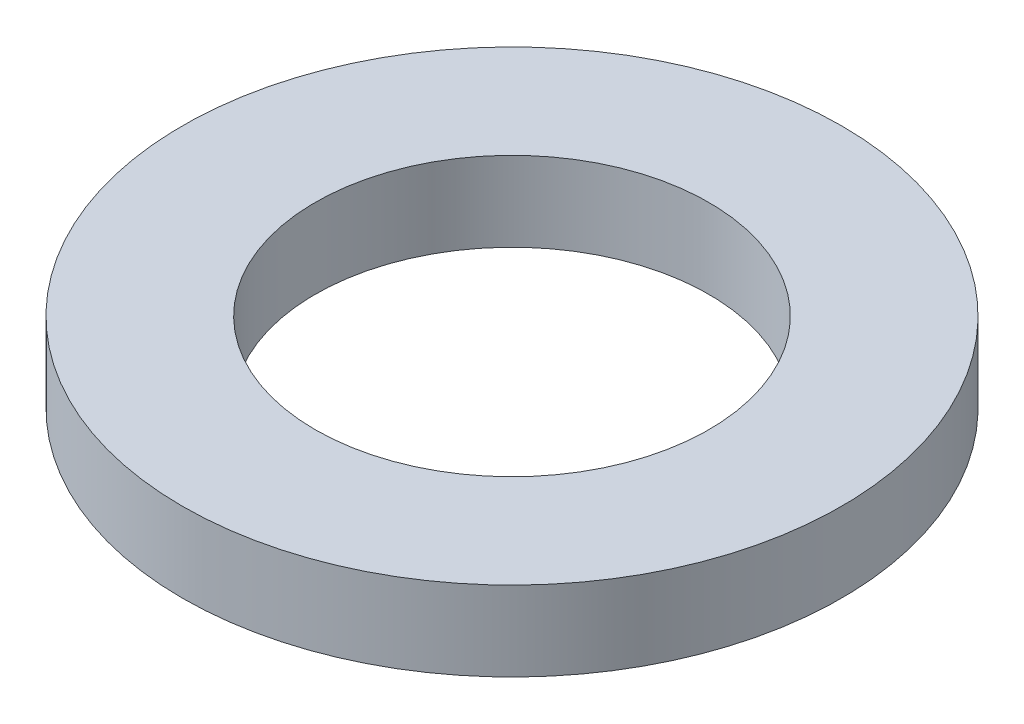
from build123d import *

# Parameters (mm, degrees)
SKETCH1_R           = 1.8923
BOSS_EXTRUDE1_DEPTH = 0.4572
SKETCH5_R           = 1.1303
CUT_EXTRUDE1_DEPTH  = 3.714890499


with BuildPart() as part:
    # Sketch1 → Boss-Extrude1 (new body)
    with BuildSketch(Plane(origin=(0, 0, 0), x_dir=(1, 0, 0), z_dir=(0, 1, 0))):
        with Locations(Location((0, 0, 0), (0, 0, 270))):
            Circle(SKETCH1_R)
    extrude(amount=BOSS_EXTRUDE1_DEPTH)

    # Sketch5 → Cut-Extrude1 (cut, through all)
    with BuildSketch(Plane(origin=(0, 0.4572, 0), x_dir=(-1, 0, 0), z_dir=(0, 1, 0))):
        with Locations(Location((0, 0, 0), (0, 0, 90))):
            Circle(SKETCH5_R)
    extrude(amount=-CUT_EXTRUDE1_DEPTH, mode=Mode.SUBTRACT)


solid = part.part
